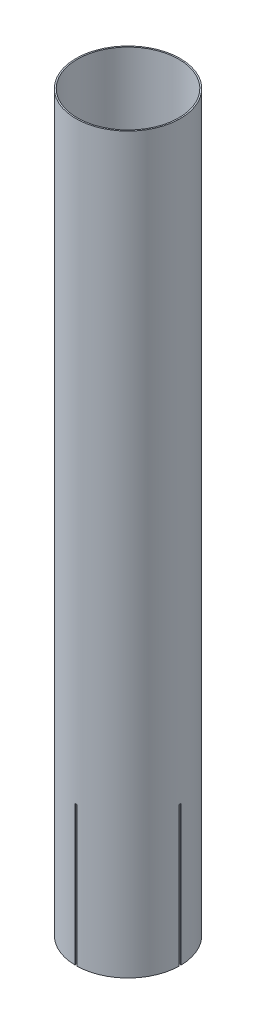
from build123d import *

# Parameters (mm, degrees)
SKETCH1_W          = 2
SKETCH1_H          = 1100
CUT_EXTRUDE1_DEPTH = 1.5
CIRPATTERN1_COUNT  = 4


with BuildPart() as part:
    # Sketch1 → Revolve1 (revolve)
    with BuildSketch(Plane.XY):
        with Locations((77.2, 550)):
            Rectangle(SKETCH1_W, SKETCH1_H)
    revolve(axis=Axis((0, 0, 0), (0, 1, 0)))

    # Sketch2 → Cut-Extrude1 (cut, symmetric)
    with BuildSketch(Plane.XY):
        Polygon((-185.2, 150), (-185.2, 0), (-78.2, 0), (0, 0), (0, 210), (-78.2, 210), align=None)
    cut_extrude1 = extrude(amount=CUT_EXTRUDE1_DEPTH, both=True, mode=Mode.SUBTRACT)

    # CirPattern1: Cut-Extrude1 ×4 about axis
    cirpattern1_axis = Axis((0, 0, 0), (0, -1, 0))
    for i in range(1, CIRPATTERN1_COUNT):
        add(cut_extrude1.rotate(cirpattern1_axis, i * 360 / CIRPATTERN1_COUNT), mode=Mode.SUBTRACT)


solid = part.part
